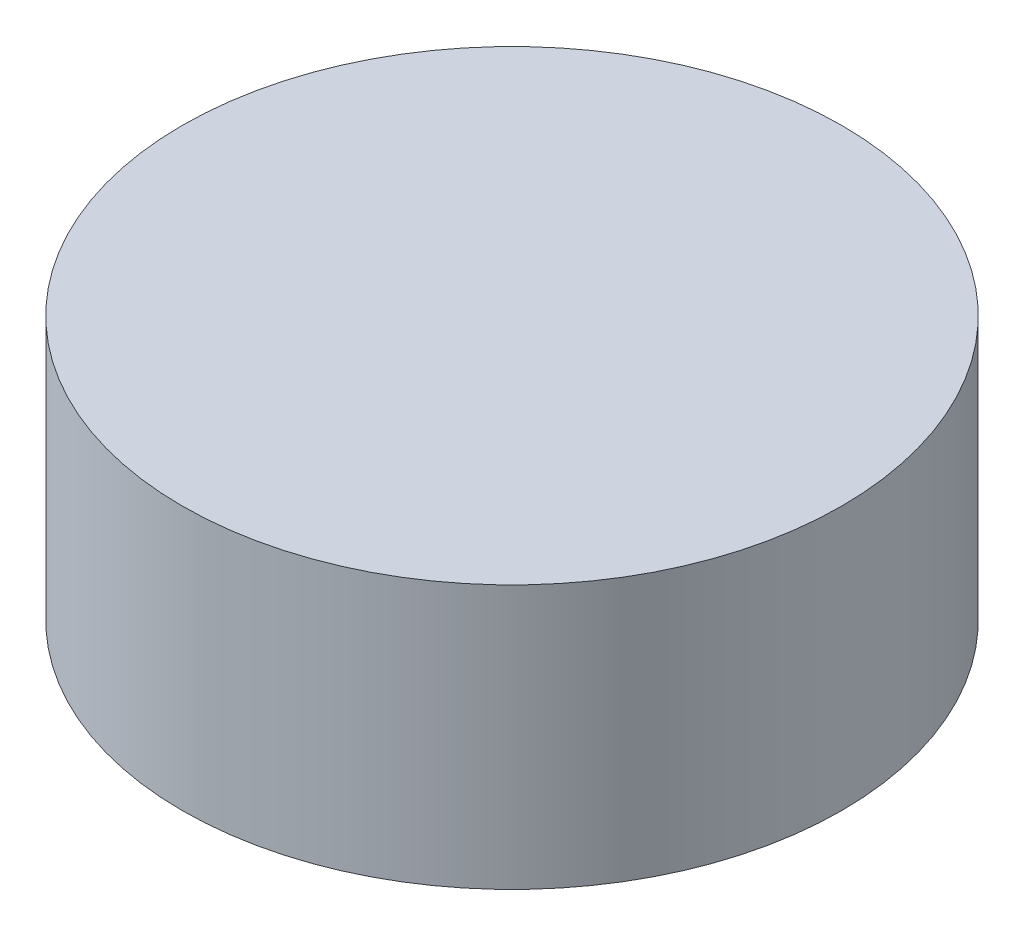
from build123d import *

# Parameters (mm, degrees)
CROQUIS1_R              = 25
SALIENTE_EXTRUIR1_DEPTH = 20


with BuildPart() as part:
    # Croquis1 → Saliente-Extruir1 (new body)
    with BuildSketch(Plane(origin=(0, 0, 0), x_dir=(1, 0, 0), z_dir=(0, 1, 0))):
        with Locations(Location((0, 0, 0), (0, 0, 270))):
            Circle(CROQUIS1_R)
    extrude(amount=SALIENTE_EXTRUIR1_DEPTH)


solid = part.part
